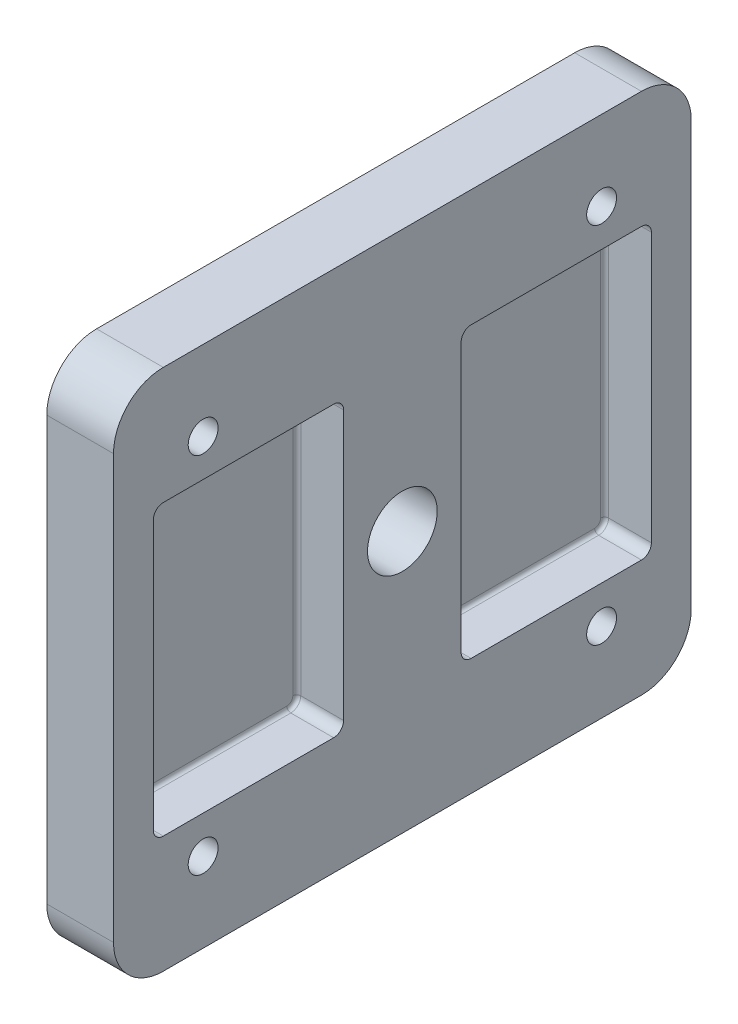
from build123d import *

# Parameters (mm, degrees)
SKETCH_1_R          = 1.5
EXTRUDE_1_DEPTH     = 6.7
SKETCH_2_W          = 19.1
SKETCH_2_H          = 29
EXTRUDE_2_DEPTH     = 2
CUT_EXTRUDE_1_REACH = 80.518
SKETCH_3_R          = 3.5
FILLET_1_R          = 0.4


with BuildPart() as part:
    # 草图1 → 凸台-拉伸1 (new body)
    with BuildSketch(Plane(origin=(0, 0, 0), x_dir=(0, 0, -1), z_dir=(1, 0, 0))):
        with BuildLine():
            Line((5, 0), (53, 0))
            ThreePointArc((53, 0), (56.535533906, -1.464466094), (58, -5))
            Line((58, -5), (58, -47.5))
            ThreePointArc((58, -47.5), (56.535533906, -51.035533906), (53, -52.5))
            Line((53, -52.5), (5, -52.5))
            ThreePointArc((5, -52.5), (1.464466094, -51.035533906), (0, -47.5))
            Line((0, -47.5), (0, -5))
            ThreePointArc((0, -5), (1.464466094, -1.464466094), (5, 0))
        make_face()
        with Locations((9, -8)):
            Circle(SKETCH_1_R, mode=Mode.SUBTRACT)
        with Locations((49, -8)):
            Circle(SKETCH_1_R, mode=Mode.SUBTRACT)
        with Locations((49, -44.5)):
            Circle(SKETCH_1_R, mode=Mode.SUBTRACT)
        with Locations((9, -44.5)):
            Circle(SKETCH_1_R, mode=Mode.SUBTRACT)
        with BuildLine():
            Line((5, -40.75), (22.1, -40.75))
            ThreePointArc((22.1, -40.75), (22.807106781, -40.457106781), (23.1, -39.75))
            Line((23.1, -39.75), (23.1, -12.75))
            ThreePointArc((23.1, -12.75), (22.807106781, -12.042893219), (22.1, -11.75))
            Line((22.1, -11.75), (5, -11.75))
            ThreePointArc((5, -11.75), (4.292893219, -12.042893219), (4, -12.75))
            Line((4, -12.75), (4, -39.75))
            ThreePointArc((4, -39.75), (4.292893219, -40.457106781), (5, -40.75))
        make_face(mode=Mode.SUBTRACT)
        with BuildLine():
            Line((53, -11.75), (35.9, -11.75))
            ThreePointArc((35.9, -11.75), (35.192893219, -12.042893219), (34.9, -12.75))
            Line((34.9, -12.75), (34.9, -39.75))
            ThreePointArc((34.9, -39.75), (35.192893219, -40.457106781), (35.9, -40.75))
            Line((35.9, -40.75), (53, -40.75))
            ThreePointArc((53, -40.75), (53.707106781, -40.457106781), (54, -39.75))
            Line((54, -39.75), (54, -12.75))
            ThreePointArc((54, -12.75), (53.707106781, -12.042893219), (53, -11.75))
        make_face(mode=Mode.SUBTRACT)
    extrude(amount=EXTRUDE_1_DEPTH)

    # 草图2 → 凸台-拉伸2 (add)
    with BuildSketch(Plane.ZY):
        with Locations((-13.55, -26.25)):
            Rectangle(SKETCH_2_W, SKETCH_2_H)
        with Locations((-44.45, -26.25)):
            Rectangle(SKETCH_2_W, SKETCH_2_H)
    extrude(amount=-EXTRUDE_2_DEPTH)

    # 草图3 → 切除-拉伸1 (cut, up to next)
    with BuildSketch(Plane(origin=(6.7, 0, 0), x_dir=(0, 0, -1), z_dir=(1, 0, 0)), mode=Mode.PRIVATE) as cut_extrude_1_sk1:
        with Locations((29, -26.25)):
            Circle(SKETCH_3_R)
    cut_extrude_1_tool1 = extrude(cut_extrude_1_sk1.sketch, amount=-CUT_EXTRUDE_1_REACH, mode=Mode.PRIVATE) & part.part
    add(cut_extrude_1_tool1.solids().sort_by_distance((6.7, -26.25, -29))[0], mode=Mode.SUBTRACT)

    # 圆角1
    fillet_1_edges = [part.edges().sort_by_distance(p)[0] for p in [
        (2, -26.25, -4),
        (2, -40.75, -13.55),
        (2, -26.25, -23.1),
        (2, -12.042893219, -4.292893219),
        (2, -40.457106781, -4.292893219),
        (2, -40.457106781, -22.807106781),
        (2, -12.042893219, -22.807106781),
        (2, -26.25, -34.9),
        (2, -40.75, -44.45),
        (2, -26.25, -54),
        (2, -11.75, -44.45),
        (2, -40.457106781, -35.192893219),
        (2, -40.457106781, -53.707106781),
        (2, -12.042893219, -53.707106781),
        (2, -12.042893219, -35.192893219),
        (2, -11.75, -13.55),
    ]]
    fillet(fillet_1_edges, radius=FILLET_1_R)


solid = part.part
